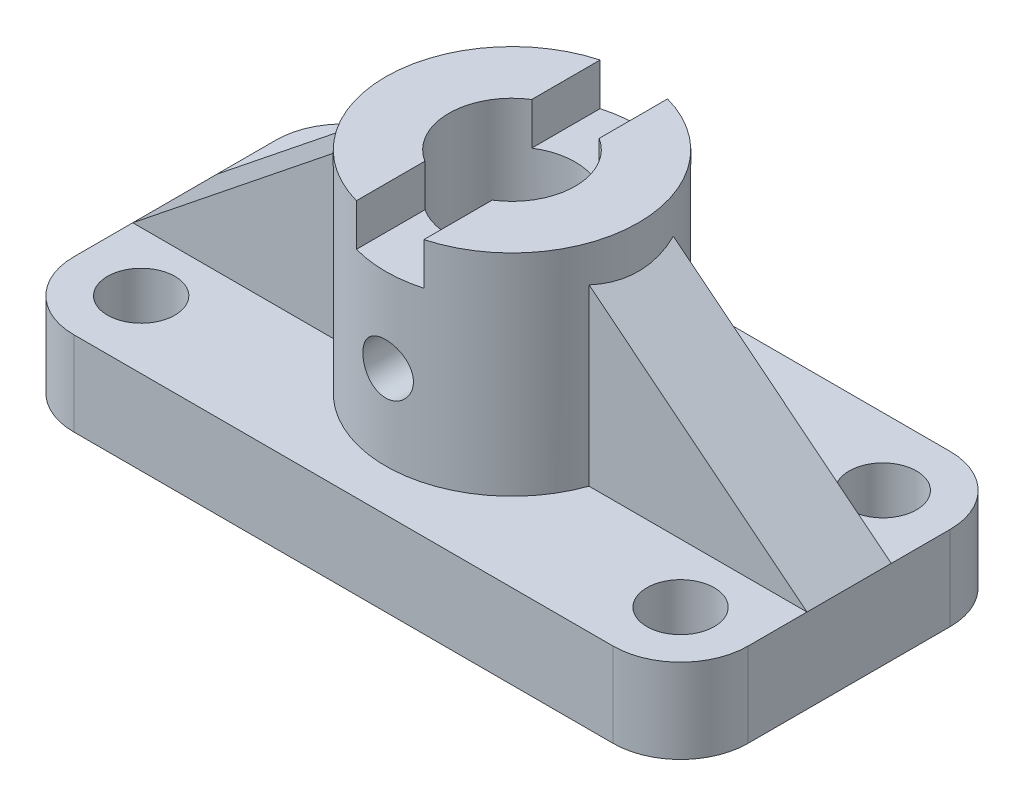
from build123d import *

# Parameters (mm, degrees)
SKETCH_1_W               = 80
SKETCH_1_H               = 40
EXTRUDE_1_DEPTH          = 10
FILLET_1_R               = 8
SKETCH_2_R               = 15
SKETCH_2_R_2             = 7.5
EXTRUDE_2_DEPTH          = 25
RIB_1_REACH              = 58.789
SKETCH_3_WALL_W          = 147.593788104
SKETCH_3_WALL_H          = 10
SKETCH_4_R               = 4
CUT_EXTRUDE_1_DEPTH      = 52.23475383
MIRROR_4_COPY_1_SKETCH_R = 4
MIRROR_4_COPY_1_DEPTH    = 52.23475383
MIRROR_4_COPY_2_SKETCH_R = 4
MIRROR_4_COPY_2_DEPTH    = 52.23475383
SKETCH_5_W               = 8
SKETCH_5_H               = 31.29917875
CUT_EXTRUDE_2_DEPTH      = 5
CUT_EXTRUDE_4_DEPTH      = 57.789083458
CUT_EXTRUDE_4_DEPTH_BACK = 57.789083458
SKETCH_6_R               = 3


with BuildPart() as part:
    # 草图1 → 凸台-拉伸1 (new body)
    with BuildSketch(Plane(origin=(0, 0, 0), x_dir=(1, 0, 0), z_dir=(0, 1, 0))):
        Rectangle(SKETCH_1_W, SKETCH_1_H)
    extrude(amount=EXTRUDE_1_DEPTH)

    # 圆角1
    fillet_1_edges = [part.edges().sort_by_distance(p)[0] for p in [
        (-40, 5, -20),
        (40, 5, -20),
        (40, 5, 20),
        (-40, 5, 20),
    ]]
    fillet(fillet_1_edges, radius=FILLET_1_R)

    # 草图2 → 凸台-拉伸2 (add)
    with BuildSketch(Plane(origin=(0, 10, 0), x_dir=(1, 0, 0), z_dir=(0, 1, 0))):
        with Locations(Location((0, 0, 0), (0, 0, 270))):
            Circle(SKETCH_2_R)
        with Locations(Location((0, 0, 0), (0, 0, 270))):
            Circle(SKETCH_2_R_2, mode=Mode.SUBTRACT)
    extrude(amount=EXTRUDE_2_DEPTH)

    # 草图3 wall → 筋1 (add, up to next)
    with BuildSketch(Plane(origin=(27.5, 20, 0), x_dir=(0.780868809443, -0.624695047554, 0), z_dir=(0.624695047554, 0.780868809443, 0)), mode=Mode.PRIVATE) as rib_1_sk1:
        Rectangle(SKETCH_3_WALL_W, SKETCH_3_WALL_H)
    rib_1_tool1 = extrude(rib_1_sk1.sketch, amount=-RIB_1_REACH, mode=Mode.PRIVATE) - part.part
    rib_1 = rib_1_tool1.solids().sort_by_distance((27.5, 20, 0))[0]
    add(rib_1)

    # 镜向1: 筋1 across plane
    add(rib_1.mirror(Plane(origin=(0, 0, 0), x_dir=(0, 0, 1), z_dir=(1, 0, 0))))

    # 草图4 → 切除-拉伸1 (cut, through all)
    with BuildSketch(Plane(origin=(0, 10, 0), x_dir=(1, 0, 0), z_dir=(0, 1, 0))):
        with Locations(Location((32, 12, 0), (0, 0, 270))):
            Circle(SKETCH_4_R)
    cut_extrude_1 = extrude(amount=-CUT_EXTRUDE_1_DEPTH, mode=Mode.SUBTRACT)

    # 镜向2: 切除-拉伸1 across plane
    add(cut_extrude_1.mirror(Plane.XY), mode=Mode.SUBTRACT)

    # 镜向3: 切除-拉伸1 across plane
    add(cut_extrude_1.mirror(Plane(origin=(0, 0, 0), x_dir=(0, 0, 1), z_dir=(1, 0, 0))), mode=Mode.SUBTRACT)

    # 镜向4 copy 1 sketch → 镜向4 copy 1 (cut, through all)
    with BuildSketch(Plane(origin=(0, 10, 0), x_dir=(-1, 0, 0), z_dir=(0, 1, 0))):
        with Locations(Location((32, 12, 0), (0, 0, 270))):
            Circle(MIRROR_4_COPY_1_SKETCH_R)
    extrude(amount=-MIRROR_4_COPY_1_DEPTH, mode=Mode.SUBTRACT)

    # 镜向4 copy 2 sketch → 镜向4 copy 2 (cut, through all)
    with BuildSketch(Plane(origin=(0, 10, 0), x_dir=(1, 0, 0), z_dir=(0, 1, 0))):
        with Locations((32, -12)):
            Circle(MIRROR_4_COPY_2_SKETCH_R)
    extrude(amount=-MIRROR_4_COPY_2_DEPTH, mode=Mode.SUBTRACT)

    # 草图5 → 切除-拉伸2 (cut)
    with BuildSketch(Plane(origin=(0, 35, 0), x_dir=(1, 0, 0), z_dir=(0, 1, 0))):
        Rectangle(SKETCH_5_W, SKETCH_5_H)
    extrude(amount=-CUT_EXTRUDE_2_DEPTH, mode=Mode.SUBTRACT)

    # 草图6 → 切除-拉伸4 (cut, two sides: drawn at the far end of the back side and taken through both)
    with BuildSketch(Plane.XY.offset(-CUT_EXTRUDE_4_DEPTH_BACK)):
        with Locations((0, 20)):
            Circle(SKETCH_6_R)
    extrude(amount=CUT_EXTRUDE_4_DEPTH + CUT_EXTRUDE_4_DEPTH_BACK, mode=Mode.SUBTRACT)


solid = part.part
